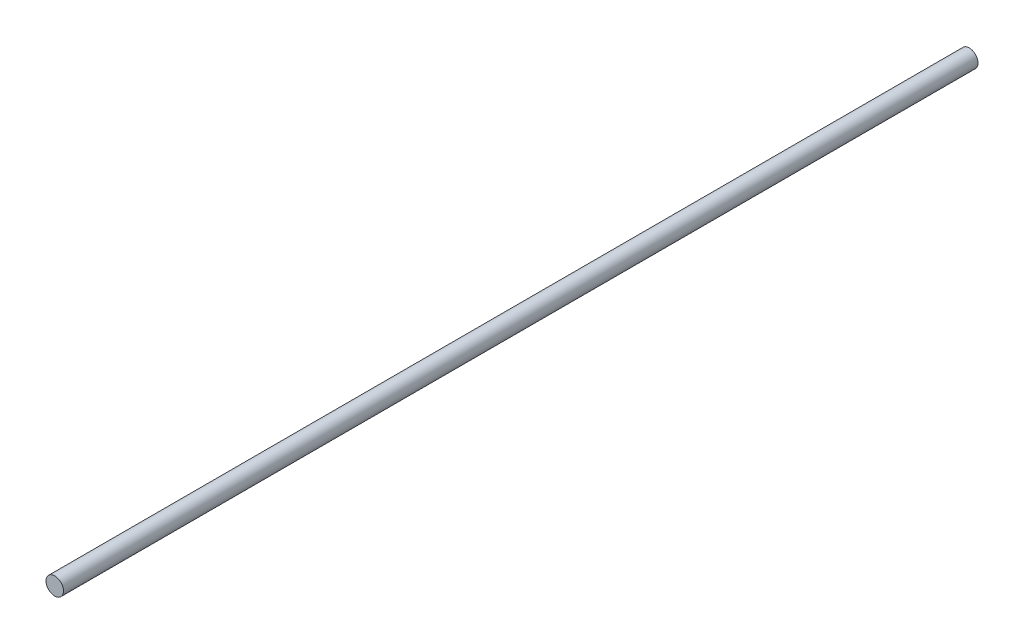
from build123d import *

# Parameters (mm, degrees)
SKETCH_1_W = 3.25
SKETCH_1_H = 340


with BuildPart() as part:
    # Эскиз1 → Повернуть1 (revolve)
    with BuildSketch(Plane(origin=(0, 0, 0), x_dir=(1, 0, 0), z_dir=(0, 1, 0))):
        with Locations((1.625, -170)):
            Rectangle(SKETCH_1_W, SKETCH_1_H)
    revolve(axis=Axis((0, 0, 0), (0, 0, 1)))


solid = part.part
